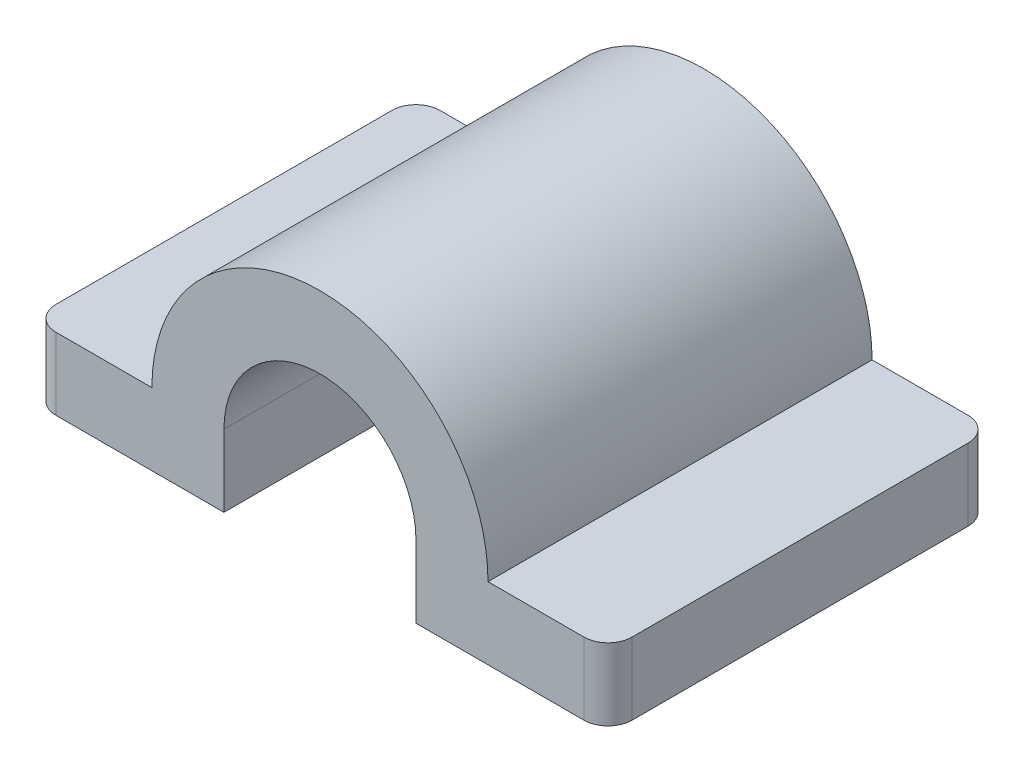
from build123d import *

# Parameters (mm, degrees)
EXTRUDE_1_DEPTH = 80
FILLET_1_R      = 5


with BuildPart() as part:
    # Эскиз1 → Бобышка-Вытянуть1 (new body)
    with BuildSketch(Plane.XY):
        with BuildLine():
            Line((-60, 0), (-20, 0))
            Line((-20, 0), (-20, 15))
            ThreePointArc((-20, 15), (0, 35), (20, 15))
            Line((20, 15), (20, 0))
            Line((20, 0), (60, 0))
            Line((60, 0), (60, 15))
            Line((60, 15), (35, 15))
            ThreePointArc((35, 15), (0, 50), (-35, 15))
            Line((-35, 15), (-60, 15))
            Line((-60, 15), (-60, 0))
        make_face()
    extrude(amount=-EXTRUDE_1_DEPTH)

    # Скругление1
    fillet_1_edges = [part.edges().sort_by_distance(p)[0] for p in [
        (60, 7.5, 0),
        (-60, 7.5, 0),
        (60, 7.5, -80),
        (-60, 7.5, -80),
    ]]
    fillet(fillet_1_edges, radius=FILLET_1_R)


solid = part.part
